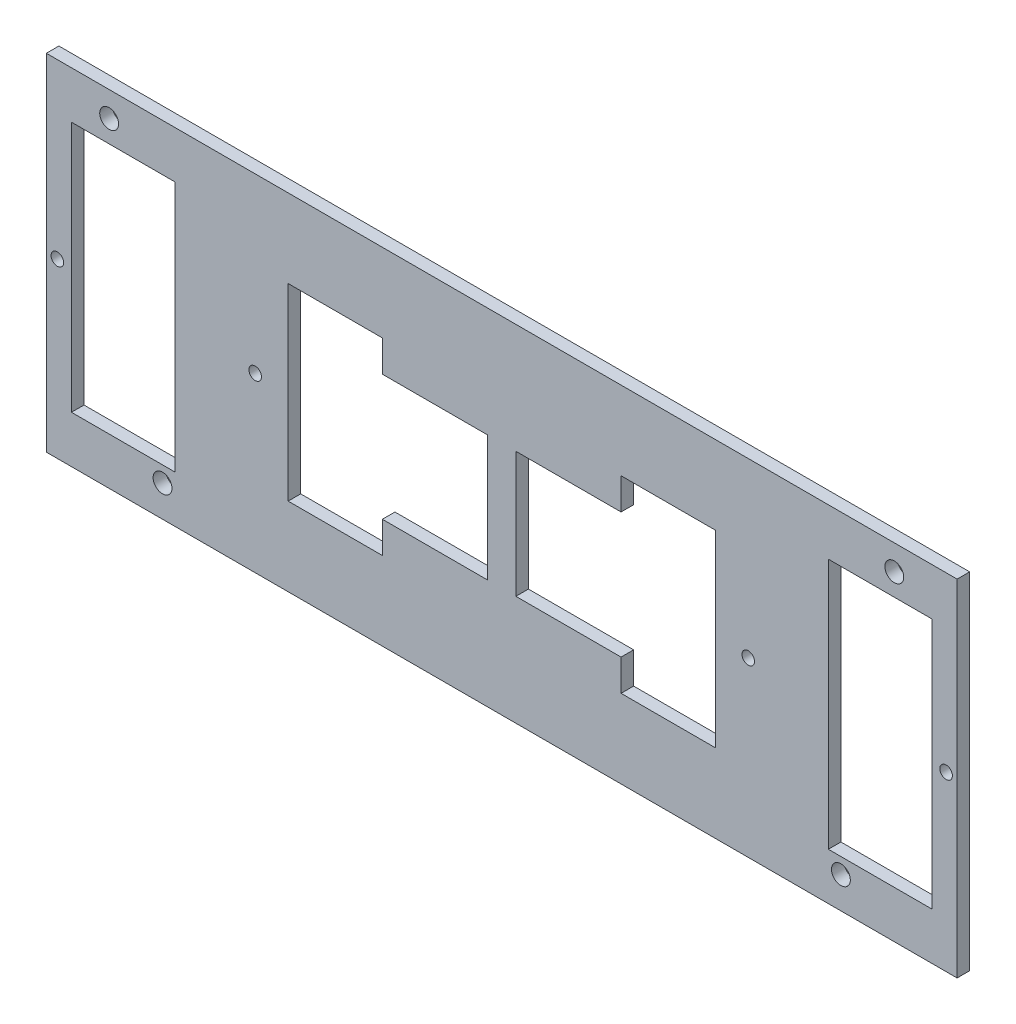
from build123d import *

# Parameters (mm, degrees)
SKETCH1_R           = 3
SKETCH1_W           = 33
SKETCH1_H           = 80
BOSS_EXTRUDE1_DEPTH = 4
SKETCH4_R           = 2
CUT_EXTRUDE2_DEPTH  = 10
SKETCH5_R           = 2
CUT_EXTRUDE3_DEPTH  = 10


with BuildPart() as part:
    # Sketch1 → Boss-Extrude1 (new body)
    with BuildSketch(Plane.XY):
        Polygon((-145, -20.635083269), (-145, -55), (145, -55), (145, -20.635083269), (145, 40), (145, 55), (-145, 55), (-145, 40), align=None)
        with Locations((-108, -45)):
            Circle(SKETCH1_R, mode=Mode.SUBTRACT)
        with Locations((-125, 47)):
            Circle(SKETCH1_R, mode=Mode.SUBTRACT)
        with Locations(Location((125, 47, 0), (0, 0, 180))):
            Circle(SKETCH1_R, mode=Mode.SUBTRACT)
        with Locations(Location((108, -45, 0), (0, 0, 180))):
            Circle(SKETCH1_R, mode=Mode.SUBTRACT)
        with Locations((-120.5, 0)):
            Rectangle(SKETCH1_W, SKETCH1_H, mode=Mode.SUBTRACT)
        Polygon((-68, -30), (-38, -30), (-38, -20), (-4.5, -20), (-4.5, 20), (-38, 20), (-38, 30), (-68, 30), align=None, mode=Mode.SUBTRACT)
        Polygon((38, 20), (38, 30), (68, 30), (68, -30), (38, -30), (38, -20), (4.5, -20), (4.5, 20), align=None, mode=Mode.SUBTRACT)
        with Locations((120.5, 0)):
            Rectangle(SKETCH1_W, SKETCH1_H, mode=Mode.SUBTRACT)
    extrude(amount=BOSS_EXTRUDE1_DEPTH)

    # Sketch4 → Cut-Extrude2 (cut)
    with BuildSketch(Plane(origin=(0, 0, 0), x_dir=(-1, 0, 0), z_dir=(0, 0, -1))):
        with Locations((-141.5, 0)):
            Circle(SKETCH4_R)
    cut_extrude2 = extrude(amount=-CUT_EXTRUDE2_DEPTH, mode=Mode.SUBTRACT)

    # Sketch5 → Cut-Extrude3 (cut)
    with BuildSketch(Plane(origin=(0, 0, 0), x_dir=(-1, 0, 0), z_dir=(0, 0, -1))):
        with Locations((-78.5, 0)):
            Circle(SKETCH5_R)
    cut_extrude3 = extrude(amount=-CUT_EXTRUDE3_DEPTH, mode=Mode.SUBTRACT)

    # Mirror1: Cut-Extrude2, Cut-Extrude3 across plane
    add(cut_extrude2.mirror(Plane.ZY), mode=Mode.SUBTRACT)
    add(cut_extrude3.mirror(Plane.ZY), mode=Mode.SUBTRACT)


solid = part.part
